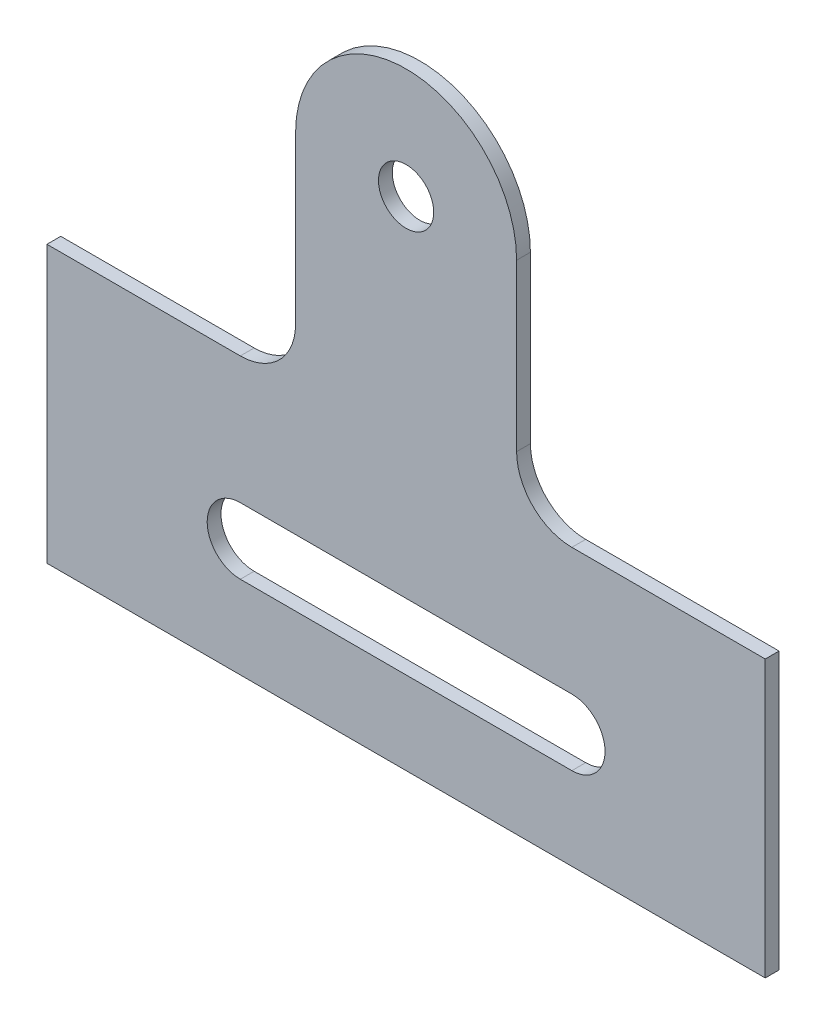
from build123d import *

# Parameters (mm, degrees)
SKIZZE1_R                       = 5
AUFSATZ_LINEAR_AUSTRAGEN1_DEPTH = 2.5


with BuildPart() as part:
    # Skizze1 → Aufsatz-Linear austragen1 (new body)
    with BuildSketch(Plane.XY):
        with BuildLine():
            Line((-65, 0), (65, 0))
            Line((65, 0), (65, 50))
            Line((65, 50), (30, 50))
            ThreePointArc((30, 50), (22.928932188, 52.928932188), (20, 60))
            Line((20, 60), (20, 90))
            ThreePointArc((20, 90), (0, 110), (-20, 90))
            Line((-20, 90), (-20, 60))
            ThreePointArc((-20, 60), (-22.928932188, 52.928932188), (-30, 50))
            Line((-30, 50), (-65, 50))
            Line((-65, 50), (-65, 0))
        make_face()
        with Locations((0, 90)):
            Circle(SKIZZE1_R, mode=Mode.SUBTRACT)
        with BuildLine():
            Line((-30, 27), (30, 27))
            ThreePointArc((30, 27), (36, 21), (30, 15))
            Line((30, 15), (-30, 15))
            ThreePointArc((-30, 15), (-36, 21), (-30, 27))
        make_face(mode=Mode.SUBTRACT)
    extrude(amount=AUFSATZ_LINEAR_AUSTRAGEN1_DEPTH)


solid = part.part
